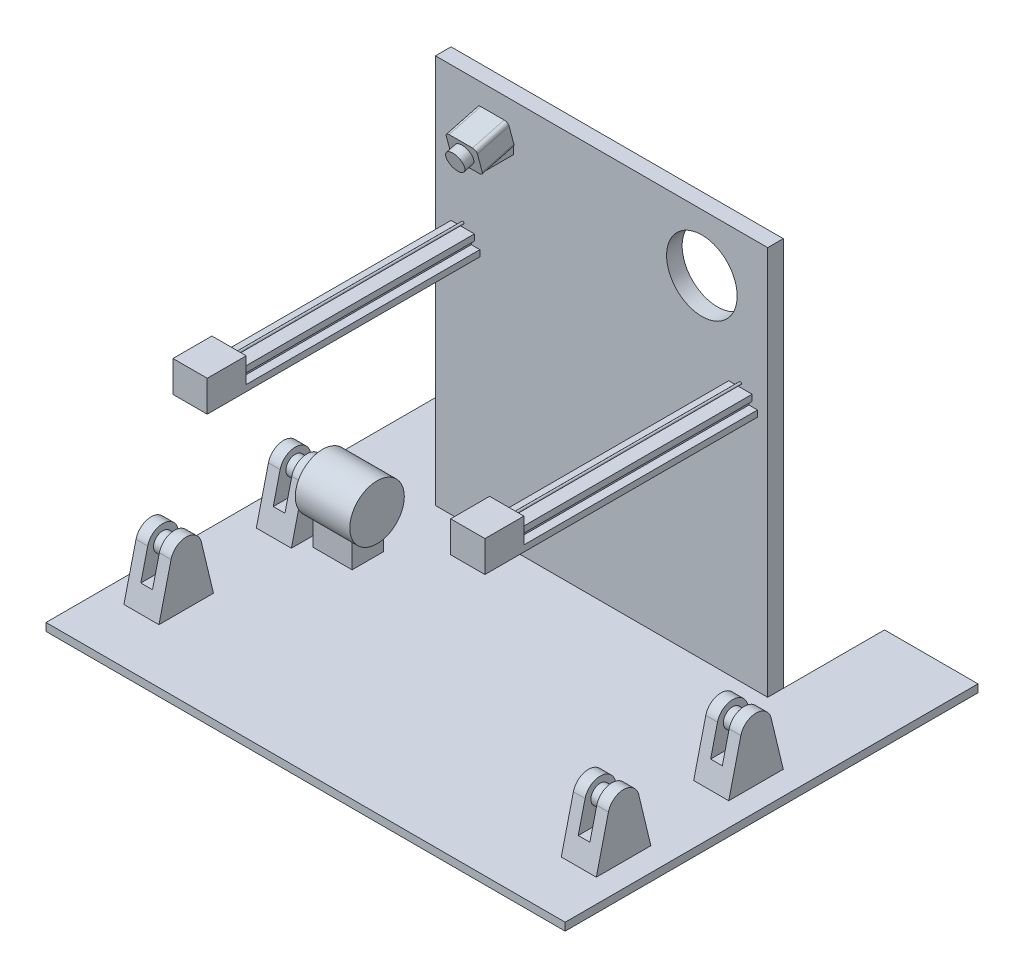
from build123d import *

# Parameters (mm, degrees)
SKETCH_2_W            = 666.5
SKETCH_2_H            = 490
EXTRUDE_1_DEPTH       = 500
SKETCH_3_W            = 45
SKETCH_3_H            = 70
EXTRUDE_2_DEPTH       = 80
CUT_EXTRUDE_1_DEPTH   = 800
EXTRUDE_5_DEPTH       = 500
SKETCH_8_R            = 1.5
EXTRUDE_6_DEPTH       = 300
SKETCH_20_W           = 751.278853788
SKETCH_20_H           = 520
CUT_EXTRUDE_5_DEPTH   = 490
SKETCH_22_R           = 12
CUT_EXTRUDE_7_DEPTH   = 15
SKETCH_23_W           = 120
SKETCH_23_H           = 200
CUT_EXTRUDE_8_DEPTH   = 30
SKETCH_24_W           = 20
SKETCH_24_H           = 10
EXTRUDE_10_DEPTH      = 40
SKETCH_25_W           = 20
SKETCH_25_H           = 15
EXTRUDE_11_DEPTH      = 10
EXTRUDE_12_DEPTH      = 12
EXTRUDE_12_DEPTH_BACK = 30
FILLET_1_R            = 5
SKETCH_27_R           = 12
EXTRUDE_13_DEPTH      = 12
SKETCH_28_R           = 12
EXTRUDE_14_DEPTH      = 5
SKETCH_29_R           = 35
EXTRUDE_15_DEPTH      = 70
EXTRUDE_16_DEPTH      = 33
CUT_EXTRUDE_START     = -15
SKETCH_31_R           = 12
CUT_EXTRUDE_9_DEPTH   = 15
SKETCH_32_W           = 426.5
SKETCH_32_H           = 130
CUT_EXTRUDE_10_DEPTH  = 126
SKETCH_33_R           = 45.31
CUT_EXTRUDE_11_DEPTH  = 44
SKETCH_35_W           = 44
SKETCH_35_H           = 40
EXTRUDE_17_DEPTH      = 50
SKETCH_37_W           = 666.5
SKETCH_37_H           = 10
EXTRUDE_19_DEPTH      = 40
SKETCH_38_W           = 120
SKETCH_38_H           = 10
EXTRUDE_20_DEPTH      = 200


with BuildPart() as part:
    # 草图2 → 凸台-拉伸1 (new body)
    with BuildSketch(Plane(origin=(0, 0, 0), x_dir=(1, 0, 0), z_dir=(0, 1, 0))):
        with Locations((333.25, 255)):
            Rectangle(SKETCH_2_W, SKETCH_2_H)
    extrude(amount=EXTRUDE_1_DEPTH)

    # 草图3 → 凸台-拉伸2 (add)
    with BuildSketch(Plane(origin=(0, 500, 0), x_dir=(1, 0, 0), z_dir=(0, 1, 0))):
        with Locations((52.5, 75)):
            Rectangle(SKETCH_3_W, SKETCH_3_H)
        with Locations((52.5, 245)):
            Rectangle(SKETCH_3_W, SKETCH_3_H)
        with Locations((614, 245)):
            Rectangle(SKETCH_3_W, SKETCH_3_H)
        with Locations((614, 75)):
            Rectangle(SKETCH_3_W, SKETCH_3_H)
    extrude(amount=EXTRUDE_2_DEPTH)

    # 草图4 → 切除-拉伸1 (cut)
    with BuildSketch(Plane.ZY.offset(-30)):
        with BuildLine():
            Line((-280, 500), (-264.445556098, 564.676574391))
            ThreePointArc((-264.445556098, 564.676574391), (-245, 580), (-225.554443902, 564.676574391))
            Line((-225.554443902, 564.676574391), (-210, 500))
            Line((-210, 500), (-110, 500))
            Line((-110, 500), (-94.445556098, 564.676574391))
            ThreePointArc((-94.445556098, 564.676574391), (-75, 580), (-55.554443902, 564.676574391))
            Line((-55.554443902, 564.676574391), (-40, 500))
            Line((-40, 500), (-40, 590.908516605))
            Line((-40, 590.908516605), (-280, 590.908516605))
            Line((-280, 590.908516605), (-280, 580))
            Line((-280, 580), (-280, 500))
        make_face()
    extrude(amount=-CUT_EXTRUDE_1_DEPTH, mode=Mode.SUBTRACT)

    # 草图7 → 凸台-拉伸5 (add)
    with BuildSketch(Plane(origin=(0, 500, 0), x_dir=(1, 0, 0), z_dir=(0, 1, 0))):
        Polygon((476.5, 370), (546.5, 370), (546.5, 350), (476.5, 350), (120, 350), (120, 370), align=None)
    extrude(amount=EXTRUDE_5_DEPTH)

    # 草图8 → 凸台-拉伸6 (add)
    with BuildSketch(Plane.XY.offset(-350)):
        with Locations(Location((155, 832, 0), (0, 0, 180))):
            Circle(SKETCH_8_R)
        with Locations(Location((511.5, 832, 0), (0, 0, 180))):
            Circle(SKETCH_8_R)
        Polygon((177, 805), (177, 813), (166, 813), (166, 819), (170, 819), (170, 827), (140, 827), (140, 819), (144, 819), (144, 813), (133, 813), (133, 805), align=None)
        Polygon((500.5, 813), (489.5, 813), (489.5, 805), (533.5, 805), (533.5, 813), (522.5, 813), (522.5, 819), (526.5, 819), (526.5, 827), (496.5, 827), (496.5, 819), (500.5, 819), align=None)
    extrude(amount=EXTRUDE_6_DEPTH)

    # 草图20 → 切除-拉伸5 (cut)
    with BuildSketch(Plane.XZ):
        with Locations((375.639426894, -260)):
            Rectangle(SKETCH_20_W, SKETCH_20_H)
    extrude(amount=-CUT_EXTRUDE_5_DEPTH, mode=Mode.SUBTRACT)

    # 草图22 → 切除-拉伸7 (cut)
    # profile 1 of 2: a face of its own
    with BuildSketch(Plane.ZY.offset(-45)):
        with BuildLine():
            Line((-264.44592578, 564.676479403), (-273.266117859, 528))
            Line((-273.266117859, 528), (-216.733882141, 528))
            Line((-216.733882141, 528), (-225.52728646, 564.563651658))
            ThreePointArc((-225.52728646, 564.563651658), (-244.942017925, 580.000253177), (-264.44592578, 564.676479403))
        make_face()
        with Locations((-245, 560)):
            Circle(SKETCH_22_R, mode=Mode.SUBTRACT)
    # profile 2 of 2: a face of its own
    with BuildSketch(Plane.ZY.offset(-45)):
        with BuildLine():
            ThreePointArc((-55.55407422, 564.676479403), (-75.057982075, 580.000253177), (-94.47271354, 564.563651658))
            Line((-94.47271354, 564.563651658), (-103.266117859, 528))
            Line((-103.266117859, 528), (-46.733882141, 528))
            Line((-46.733882141, 528), (-55.55407422, 564.676479403))
        make_face()
        with Locations((-75, 560)):
            Circle(SKETCH_22_R, mode=Mode.SUBTRACT)
    extrude(amount=-CUT_EXTRUDE_7_DEPTH, mode=Mode.SUBTRACT)

    # 草图23 → 切除-拉伸8 (cut)
    with BuildSketch(Plane(origin=(0, 500, 0), x_dir=(1, 0, 0), z_dir=(0, 1, 0))):
        with Locations((606.5, 400)):
            Rectangle(SKETCH_23_W, SKETCH_23_H)
        with Locations((60, 400)):
            Rectangle(SKETCH_23_W, SKETCH_23_H)
    extrude(amount=-CUT_EXTRUDE_8_DEPTH, mode=Mode.SUBTRACT)

    # 草图24 → 凸台-拉伸10 (add)
    with BuildSketch(Plane.XY.offset(-350)):
        with Locations((210, 945)):
            Rectangle(SKETCH_24_W, SKETCH_24_H)
    extrude(amount=EXTRUDE_10_DEPTH)

    # 草图25 → 凸台-拉伸11 (add)
    with BuildSketch(Plane(origin=(0, 950, 0), x_dir=(1, 0, 0), z_dir=(0, 1, 0))):
        with Locations((210, 317.5)):
            Rectangle(SKETCH_25_W, SKETCH_25_H)
    extrude(amount=EXTRUDE_11_DEPTH)

    # 草图26 → 凸台-拉伸12 (add, two sides: drawn at the far end of the back side and taken through both)
    with BuildSketch(Plane(origin=(0, 141.807806183, -529.233937587), x_dir=(1, 0, 0), z_dir=(0, -0.25881904510252135, 0.9659258262890681)).offset(-EXTRUDE_12_DEPTH_BACK)):
        Polygon((190, 839.594999439), (190, 869.594999439), (230, 869.594999439), (230, 839.594999439), (230, 835.594999439), (190, 835.594999439), align=None)
    extrude(amount=EXTRUDE_12_DEPTH + EXTRUDE_12_DEPTH_BACK)

    # 圆角1
    fillet_1_edges = [part.edges().sort_by_distance(p)[0] for p in [
        (230, 951.259967865, -321.659370176),
        (190, 951.259967865, -321.659370176),
        (190, 984.101445959, -312.859522643),
        (230, 984.101445959, -312.859522643),
    ]]
    fillet(fillet_1_edges, radius=FILLET_1_R)

    # 草图27 → 凸台-拉伸13 (add)
    with BuildSketch(Plane(origin=(0, 138.701977642, -517.642827671), x_dir=(1, 0, 0), z_dir=(0, -0.25881904510252535, 0.9659258262890672))):
        with Locations(Location((210, 852.594999439, 0), (0, 0, 270))):
            Circle(SKETCH_27_R)
    extrude(amount=EXTRUDE_13_DEPTH)

    # 草图28 → 凸台-拉伸14 (add)
    with BuildSketch(Plane(origin=(75, 0, 0), x_dir=(0, 0, -1), z_dir=(1, 0, 0))):
        with Locations(Location((245, 560, 0), (0, 0, 180))):
            Circle(SKETCH_28_R)
    extrude(amount=EXTRUDE_14_DEPTH)

    # 草图29 → 凸台-拉伸15 (add)
    with BuildSketch(Plane(origin=(80, 0, 0), x_dir=(0, 0, -1), z_dir=(1, 0, 0))):
        with Locations((245, 560)):
            Circle(SKETCH_29_R)
    extrude(amount=EXTRUDE_15_DEPTH)

    # 草图30 → 凸台-拉伸16 (add)
    with BuildSketch(Plane(origin=(0, 500, 0), x_dir=(1, 0, 0), z_dir=(0, 1, 0))):
        Polygon((128, 265), (138, 265), (138, 225), (128, 225), (88, 225), (88, 233), (88, 257), (88, 265), align=None)
    extrude(amount=EXTRUDE_16_DEPTH)

    # 草图31 → 切除-拉伸9 (cut)
    # profile 1 of 2: a face of its own
    with BuildSketch(Plane(origin=(621.5, 0, 0), x_dir=(0, 0, -1), z_dir=(1, 0, 0)).offset(CUT_EXTRUDE_START)):
        with BuildLine():
            Line((55.55407422, 564.676479403), (46.733882141, 528))
            Line((46.733882141, 528), (103.266117859, 528))
            Line((103.266117859, 528), (94.47271354, 564.563651658))
            ThreePointArc((94.47271354, 564.563651658), (75.057982075, 580.000253177), (55.55407422, 564.676479403))
        make_face()
        with Locations(Location((75, 560, 0), (0, 0, 180))):
            Circle(SKETCH_31_R, mode=Mode.SUBTRACT)
    # profile 2 of 2: a face of its own
    with BuildSketch(Plane(origin=(621.5, 0, 0), x_dir=(0, 0, -1), z_dir=(1, 0, 0)).offset(CUT_EXTRUDE_START)):
        with BuildLine():
            ThreePointArc((264.44592578, 564.676479403), (244.942017925, 580.000253177), (225.52728646, 564.563651658))
            Line((225.52728646, 564.563651658), (216.733882141, 528))
            Line((216.733882141, 528), (273.266117859, 528))
            Line((273.266117859, 528), (264.44592578, 564.676479403))
        make_face()
        with Locations(Location((245, 560, 0), (0, 0, 180))):
            Circle(SKETCH_31_R, mode=Mode.SUBTRACT)
    extrude(amount=CUT_EXTRUDE_9_DEPTH, mode=Mode.SUBTRACT)

    # 草图32 → 切除-拉伸10 (cut)
    with BuildSketch(Plane(origin=(0, 500, 0), x_dir=(1, 0, 0), z_dir=(0, 1, 0))):
        with Locations((333.25, 435)):
            Rectangle(SKETCH_32_W, SKETCH_32_H)
    extrude(amount=-CUT_EXTRUDE_10_DEPTH, mode=Mode.SUBTRACT)

    # 草图33 → 切除-拉伸11 (cut, along a direction that is not the sketch's normal)
    with BuildSketch(Plane.XY.offset(-350)):
        with Locations((462, 926.518617387)):
            Circle(SKETCH_33_R)
    extrude(amount=-CUT_EXTRUDE_11_DEPTH, dir=(5.875812413124604e-15, -0.031880547720424424, 0.9994916861470363), mode=Mode.SUBTRACT)

    # 草图35 → 凸台-拉伸17 (add)
    with BuildSketch(Plane.XY.offset(-50)):
        with Locations((155, 825)):
            Rectangle(SKETCH_35_W, SKETCH_35_H)
        with Locations((511.5, 825)):
            Rectangle(SKETCH_35_W, SKETCH_35_H)
    extrude(amount=EXTRUDE_17_DEPTH)

    # 草图37 → 凸台-拉伸19 (add)
    with BuildSketch(Plane.XY.offset(-10)):
        with Locations((333.25, 495)):
            Rectangle(SKETCH_37_W, SKETCH_37_H)
    extrude(amount=EXTRUDE_19_DEPTH)

    # 草图38 → 凸台-拉伸20 (add)
    with BuildSketch(Plane(origin=(0, 0, -300), x_dir=(-1, 0, 0), z_dir=(0, 0, -1))):
        with Locations((-606.5, 495)):
            Rectangle(SKETCH_38_W, SKETCH_38_H)
        with Locations((-60, 495)):
            Rectangle(SKETCH_38_W, SKETCH_38_H)
    extrude(amount=EXTRUDE_20_DEPTH)


solid = part.part
